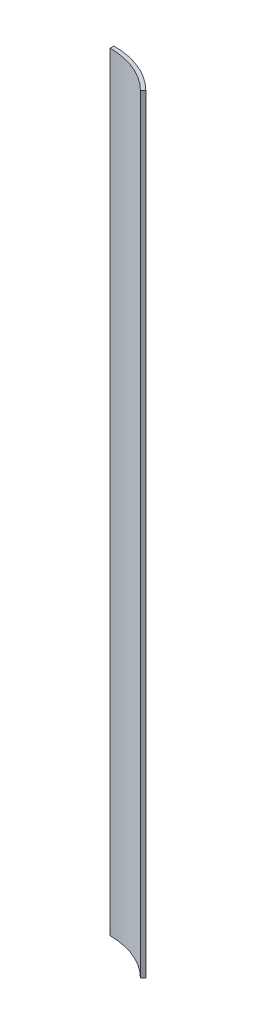
from build123d import *

# Parameters (mm, degrees)
BOSS_EXTRUDE2_DEPTH = 254


with BuildPart() as part:
    # Sketch1 → Boss-Extrude2 (new body)
    with BuildSketch(Plane(origin=(0, 0, 0), x_dir=(1, 0, 0), z_dir=(0, 1, 0))):
        with BuildLine():
            Line((0, 24.13), (0, 25.4))
            ThreePointArc((0, 25.4), (9.720159182, 23.466540126), (17.960512242, 17.960512242))
            Line((17.960512242, 17.960512242), (17.06248663, 17.06248663))
            ThreePointArc((17.06248663, 17.06248663), (9.234151223, 22.293213119), (0, 24.13))
        make_face()
    extrude(amount=BOSS_EXTRUDE2_DEPTH)


solid = part.part
